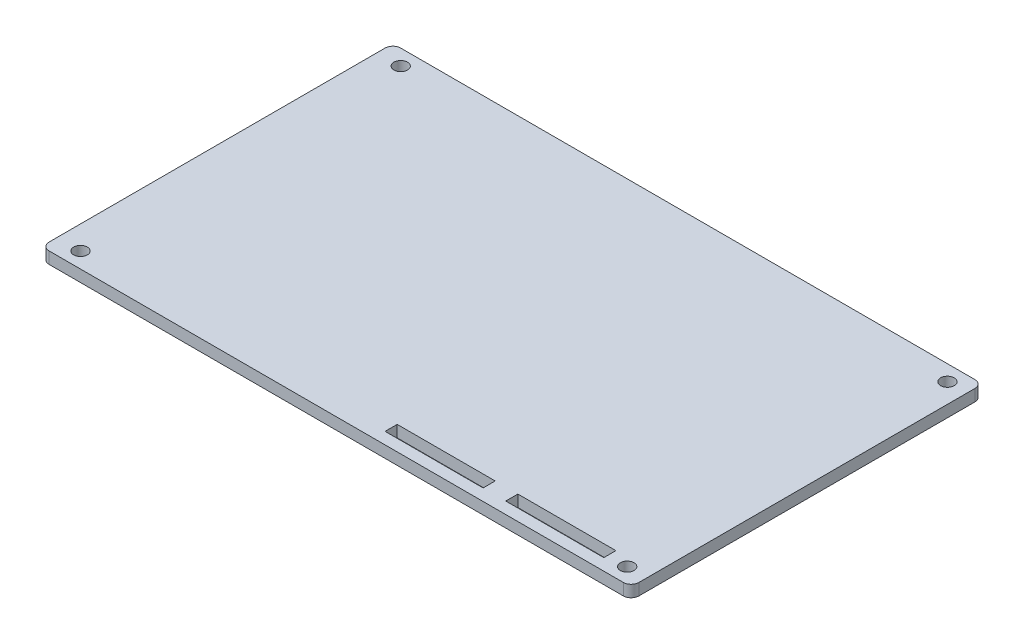
from build123d import *

# Parameters (mm, degrees)
SKETCH1_W           = 151
SKETCH1_H           = 90
BOSS_EXTRUDE1_DEPTH = 3
SKETCH2_R           = 1.75
CUT_EXTRUDE1_DEPTH  = 176.812400018
FILLET1_R           = 2
SKETCH3_W           = 25.1
SKETCH3_H           = 3.1
CUT_EXTRUDE2_DEPTH  = 176.812400018


with BuildPart() as part:
    # Sketch1 → Boss-Extrude1 (new body)
    with BuildSketch(Plane(origin=(0, 0, 0), x_dir=(1, 0, 0), z_dir=(0, 1, 0))):
        with Locations((75.5, 45)):
            Rectangle(SKETCH1_W, SKETCH1_H)
    extrude(amount=BOSS_EXTRUDE1_DEPTH)

    # Sketch2 → Cut-Extrude1 (cut, through all)
    with BuildSketch(Plane(origin=(0, 3, 0), x_dir=(1, 0, 0), z_dir=(0, 1, 0))):
        with Locations(Location((146, 86, 0), (0, 0, 270))):
            Circle(SKETCH2_R)
        with Locations(Location((146, 4, 0), (0, 0, 270))):
            Circle(SKETCH2_R)
        with Locations(Location((6, 86, 0), (0, 0, 270))):
            Circle(SKETCH2_R)
        with Locations(Location((6, 4, 0), (0, 0, 270))):
            Circle(SKETCH2_R)
    extrude(amount=-CUT_EXTRUDE1_DEPTH, mode=Mode.SUBTRACT)

    # Fillet1
    fillet1_edges = [part.edges().sort_by_distance(p)[0] for p in [
        (0, 1.5, -90),
        (151, 1.5, -90),
        (151, 1.5, 0),
        (0, 1.5, 0),
    ]]
    fillet(fillet1_edges, radius=FILLET1_R)

    # Sketch3 → Cut-Extrude2 (cut, through all)
    with BuildSketch(Plane(origin=(0, 3, 0), x_dir=(1, 0, 0), z_dir=(0, 1, 0))):
        with Locations((97.55, 4.55)):
            Rectangle(SKETCH3_W, SKETCH3_H)
        with Locations((128.45, 4.55)):
            Rectangle(SKETCH3_W, SKETCH3_H)
    extrude(amount=-CUT_EXTRUDE2_DEPTH, mode=Mode.SUBTRACT)


solid = part.part
